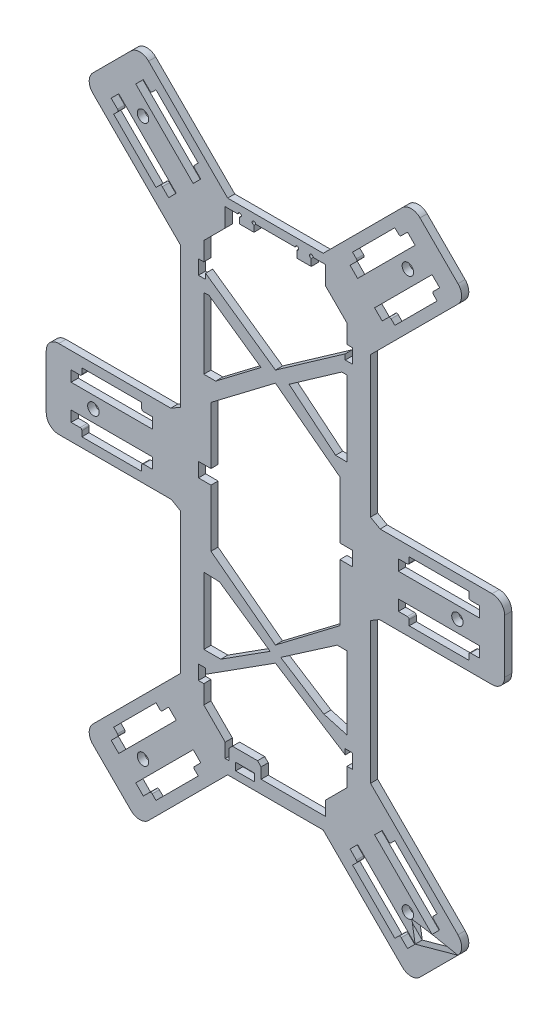
from build123d import *

# Parameters (mm, degrees)
SKETCH_1_R      = 1.6
SKETCH_1_W      = 5.20000048
SKETCH_1_H      = 2.099999983
EXTRUDE_1_DEPTH = 2
FILLET_1_R      = 3.5


with BuildPart() as part:
    # 草图1 → 凸台-拉伸1 (new body)
    with BuildSketch(Plane.XY):
        Polygon((-26.556292716, 51.843156425), (-26.556292716, 12.544385477), (-29.229747363, 11), (-64.005429013, 11), (-64.005429013, -11), (-29.033083059, -11), (-26.556292716, -12.466523206), (-26.556292716, -51.843156425), (-53.451522535, -78.738386244), (-37.895173349, -94.29473543), (-13.343143743, -69.742705824), (13.343143743, -69.742705824), (37.895173349, -94.29473543), (53.451522535, -78.738386244), (26.556292716, -51.843156425), (26.556292716, -12.466523206), (29.033083059, -11), (64.005429013, -11), (64.005429013, 11), (29.229747363, 11), (26.556292716, 12.544385477), (26.556292716, 51.843156425), (53.451522535, 78.738386244), (37.895173349, 94.29473543), (13.343143743, 69.742705824), (-13.343143743, 69.742705824), (-37.895173349, 94.29473543), (-53.451522535, 78.738386244), align=None)
        with Locations(Location((-36.982606728, 77.749638202, 0), (0, 0, 180))):
            Circle(SKETCH_1_R, mode=Mode.SUBTRACT)
        with Locations((-36.982606728, -77.749638202)):
            Circle(SKETCH_1_R, mode=Mode.SUBTRACT)
        with Locations(Location((36.982606728, -77.749638202, 0), (0, 0, 180))):
            Circle(SKETCH_1_R, mode=Mode.SUBTRACT)
        with Locations(Location((50.832714502, 9e-09, 0), (0, 0, 180))):
            Circle(SKETCH_1_R, mode=Mode.SUBTRACT)
        with Locations((-50.832714502, 9e-09)):
            Circle(SKETCH_1_R, mode=Mode.SUBTRACT)
        with Locations((36.982606728, 77.749638202)):
            Circle(SKETCH_1_R, mode=Mode.SUBTRACT)
        with BuildLine():
            Line((-36.890682834, 86.637970446), (-35.122915877, 84.870203489))
            ThreePointArc((-35.122915877, 84.870203489), (-34.76936249, 84.723756881), (-34.415809103, 84.870203489))
            Line((-34.415809103, 84.870203489), (-33.355148925, 85.930863667))
            Line((-33.355148925, 85.930863667), (-21.54646568, 74.122180422))
            Line((-21.54646568, 74.122180422), (-22.607125854, 73.061520248))
            ThreePointArc((-22.607125854, 73.061520248), (-22.753572462, 72.707966861), (-22.607125854, 72.354413474))
            Line((-22.607125854, 72.354413474), (-20.839358909, 70.586646528))
            Line((-20.839358909, 70.586646528), (-22.960679279, 68.465326158))
            Line((-22.960679279, 68.465326158), (-39.012003201, 84.516650079))
            Line((-39.012003201, 84.516650079), (-36.890682834, 86.637970446))
        make_face(mode=Mode.SUBTRACT)
        with BuildLine():
            Line((-44.10317202, 75.889947363), (-45.870938959, 77.657714302))
            Line((-45.870938959, 77.657714302), (-43.749618591, 79.779034671))
            Line((-43.749618591, 79.779034671), (-27.698294688, 63.727710768))
            Line((-27.698294688, 63.727710768), (-29.819615052, 61.606390403))
            Line((-29.819615052, 61.606390403), (-31.587381992, 63.374157343))
            ThreePointArc((-31.587381992, 63.374157343), (-31.940935379, 63.52060395), (-32.294488766, 63.374157343))
            Line((-32.294488766, 63.374157343), (-33.355148944, 62.313497165))
            Line((-33.355148944, 62.313497165), (-45.163832188, 74.122180408))
            Line((-45.163832188, 74.122180408), (-44.103172013, 75.182840582))
            ThreePointArc((-44.103172013, 75.182840582), (-43.956725405, 75.536393974), (-44.10317202, 75.889947363))
        make_face(mode=Mode.SUBTRACT)
        with BuildLine():
            Line((-45.163832188, -74.122180408), (-44.103172013, -75.182840582))
            ThreePointArc((-44.103172013, -75.182840582), (-43.956725405, -75.536393974), (-44.10317202, -75.889947363))
            Line((-44.10317202, -75.889947363), (-45.870938959, -77.657714302))
            Line((-45.870938959, -77.657714302), (-43.749618591, -79.779034671))
            Line((-43.749618591, -79.779034671), (-27.698294688, -63.727710768))
            Line((-27.698294688, -63.727710768), (-29.819615052, -61.606390403))
            Line((-29.819615052, -61.606390403), (-31.587381992, -63.374157343))
            ThreePointArc((-31.587381992, -63.374157343), (-31.940935379, -63.52060395), (-32.294488766, -63.374157343))
            Line((-32.294488766, -63.374157343), (-33.355148944, -62.313497165))
            Line((-33.355148944, -62.313497165), (-45.163832188, -74.122180408))
        make_face(mode=Mode.SUBTRACT)
        with BuildLine():
            Line((-21.54646568, -74.122180422), (-22.607125854, -73.061520248))
            ThreePointArc((-22.607125854, -73.061520248), (-22.753572462, -72.707966861), (-22.607125854, -72.354413474))
            Line((-22.607125854, -72.354413474), (-20.839358909, -70.586646528))
            Line((-20.839358909, -70.586646528), (-22.960679279, -68.465326158))
            Line((-22.960679279, -68.465326158), (-39.012003201, -84.516650079))
            Line((-39.012003201, -84.516650079), (-36.890682834, -86.637970446))
            Line((-36.890682834, -86.637970446), (-35.122915877, -84.870203489))
            ThreePointArc((-35.122915877, -84.870203489), (-34.76936249, -84.723756881), (-34.415809103, -84.870203489))
            Line((-34.415809103, -84.870203489), (-33.355148925, -85.930863667))
            Line((-33.355148925, -85.930863667), (-21.54646568, -74.122180422))
        make_face(mode=Mode.SUBTRACT)
        with BuildLine():
            Line((36.890682834, -86.637970446), (35.122915877, -84.870203489))
            ThreePointArc((35.122915877, -84.870203489), (34.76936249, -84.723756881), (34.415809103, -84.870203489))
            Line((34.415809103, -84.870203489), (33.355148925, -85.930863667))
            Line((33.355148925, -85.930863667), (21.54646568, -74.122180422))
            Line((21.54646568, -74.122180422), (22.607125854, -73.061520248))
            ThreePointArc((22.607125854, -73.061520248), (22.753572462, -72.707966861), (22.607125854, -72.354413474))
            Line((22.607125854, -72.354413474), (20.839358909, -70.586646528))
            Line((20.839358909, -70.586646528), (22.960679279, -68.465326158))
            Line((22.960679279, -68.465326158), (39.012003201, -84.516650079))
            Line((39.012003201, -84.516650079), (36.890682834, -86.637970446))
        make_face(mode=Mode.SUBTRACT)
        with BuildLine():
            Line((44.10317202, -75.889947363), (45.870938959, -77.657714302))
            Line((45.870938959, -77.657714302), (43.749618591, -79.779034671))
            Line((43.749618591, -79.779034671), (27.698294688, -63.727710768))
            Line((27.698294688, -63.727710768), (29.819615052, -61.606390403))
            Line((29.819615052, -61.606390403), (31.587381992, -63.374157343))
            ThreePointArc((31.587381992, -63.374157343), (31.940935379, -63.52060395), (32.294488766, -63.374157343))
            Line((32.294488766, -63.374157343), (33.355148944, -62.313497165))
            Line((33.355148944, -62.313497165), (45.163832188, -74.122180408))
            Line((45.163832188, -74.122180408), (44.103172013, -75.182840582))
            ThreePointArc((44.103172013, -75.182840582), (43.956725405, -75.536393974), (44.10317202, -75.889947363))
        make_face(mode=Mode.SUBTRACT)
        with Locations((-8.500000515, -66.614214344)):
            Rectangle(SKETCH_1_W, SKETCH_1_H, mode=Mode.SUBTRACT)
        Polygon((13.528986218, -41.624461883), (20.000000538, -43.441011743), (20.000000538, -23.083088156), (17.239662752, -23.083088156), (1.471001318, -33.927703554), align=None, mode=Mode.SUBTRACT)
        Polygon((-1.471001318, -33.927703554), (-15.608125856, -24.20514853), (-20.000000538, -24.037713193), (-20.000000538, -42.73048504), (-15.261717058, -42.73048504), align=None, mode=Mode.SUBTRACT)
        Polygon((-14.014716081, -66.142135104), (-12.99999939, -66.142135104), (-12.99999939, -63.14213502), (-12.000001089, -62.142135322), (-4.999999942, -62.142135322), (-3.999999778, -63.14213502), (-3.999999778, -66.142135104), (14.014717371, -66.142135104), (14.014717371, -62.156841961), (20.000000433, -56.171567844), (20.000000433, -50.999998793), (21.500000073, -50.999998793), (21.500000073, -47), (19.500000073, -47), (19.500000073, -48.500001178), (0, -36.052914104), (-19.500000073, -48.500001178), (-19.500000073, -47), (-21.500000073, -47), (-21.500000073, -50.999998793), (-20.000000538, -50.999998793), (-20.000000538, -56.171566449), (-14.014716081, -62.156841961), align=None, mode=Mode.SUBTRACT)
        with BuildLine():
            Line((54.052714512, 8.350000022), (54.052714512, 6.850000014))
            ThreePointArc((54.052714512, 6.850000014), (54.19916112, 6.496446627), (54.552714507, 6.350000019))
            Line((54.552714507, 6.350000019), (57.052714488, 6.350000019))
            Line((57.052714488, 6.350000019), (57.052714488, 3.349999981))
            Line((57.052714488, 3.349999981), (34.352714512, 3.349999981))
            Line((34.352714512, 3.349999981), (34.352714512, 6.350000018))
            Line((34.352714512, 6.350000018), (36.852714518, 6.350000018))
            ThreePointArc((36.852714518, 6.350000018), (37.206267905, 6.496446626), (37.352714513, 6.850000013))
            Line((37.352714513, 6.850000013), (37.352714513, 8.350000022))
            Line((37.352714513, 8.350000022), (54.052714512, 8.350000022))
        make_face(mode=Mode.SUBTRACT)
        with BuildLine():
            Line((54.052714507, -6.849999995), (54.052714507, -8.350000004))
            Line((54.052714507, -8.350000004), (37.35271451, -8.350000004))
            Line((37.35271451, -8.350000004), (37.35271451, -6.850000001))
            ThreePointArc((37.35271451, -6.850000001), (37.206267902, -6.496446613), (36.852714515, -6.350000006))
            Line((36.852714515, -6.350000006), (34.352714525, -6.350000006))
            Line((34.352714525, -6.350000006), (34.352714525, -3.34999997))
            Line((34.352714525, -3.34999997), (57.052714483, -3.34999997))
            Line((57.052714483, -3.34999997), (57.052714483, -6.35))
            Line((57.052714483, -6.35), (54.552714502, -6.35))
            ThreePointArc((54.552714502, -6.35), (54.199161115, -6.496446608), (54.052714507, -6.849999995))
        make_face(mode=Mode.SUBTRACT)
        Polygon((21.500000073, 2), (21.500000073, -2), (18.000000103, -2), (18.000000103, -17.999997586), (-9.85e-07, -31.671570837), (-18.00000021, -17.999997586), (-18.00000021, -2), (-21.500000073, -2), (-21.500000073, 2), (-18.00000021, 2), (-18.00000021, 18.000001311), (-9.85e-07, 31.671570837), (18.000000103, 18.000001311), (18.000000103, 2), align=None, mode=Mode.SUBTRACT)
        Polygon((-4.018224451, 33.440672617), (-18.535123967, 43.618559812), (-20.001933972, 43.56271287), (-20.001933972, 23.821064575), (-16.683399731, 23.821064575), align=None, mode=Mode.SUBTRACT)
        Polygon((16.802558383, 22.618822929), (20.001933972, 22.58927703), (20.001933972, 43.618559812), (18.535123967, 43.618559812), (3.807877689, 33.293197214), align=None, mode=Mode.SUBTRACT)
        with BuildLine():
            Line((-20.000000757, 56.171567846), (-20.000000757, 51.000000657))
            Line((-20.000000757, 51.000000657), (-21.500000073, 51.000000657))
            Line((-21.500000073, 51.000000657), (-21.500000073, 47))
            Line((-21.500000073, 47), (-19.500000073, 47))
            Line((-19.500000073, 47), (-19.500000073, 48.499995589))
            Line((-19.500000073, 48.499995589), (0, 34.828426062))
            Line((0, 34.828426062), (19.500000073, 48.499995589))
            Line((19.500000073, 48.499995589), (19.500000073, 47))
            Line((19.500000073, 47), (21.500000073, 47))
            Line((21.500000073, 47), (21.500000073, 50.999997831))
            Line((21.500000073, 50.999997831), (19.999998966, 50.999997831))
            Line((19.999998966, 50.999997831), (19.999999396, 56.171566418))
            Line((19.999999396, 56.171566418), (14.014716833, 62.15684103))
            Line((14.014716833, 62.15684103), (14.014717425, 67.343146742))
            Line((14.014717425, 67.343146742), (10.499999859, 67.343147034))
            ThreePointArc((10.499999859, 67.343147034), (9.646445327, 67.696701812), (9.999998826, 66.843146751))
            Line((9.999998826, 66.843146751), (9.999998826, 64.871536391))
            Line((9.999998826, 64.871536391), (5.99999817, 64.871536545))
            Line((5.99999817, 64.871536545), (5.99999817, 66.843146905))
            ThreePointArc((5.99999817, 66.843146905), (6.353555514, 67.6966992), (5.500000902, 67.34314745))
            Line((5.500000902, 67.34314745), (-5.500000902, 67.343148363))
            ThreePointArc((-5.500000902, 67.343148363), (-6.353555822, 67.696702161), (-6.000000052, 66.843148058))
            Line((-6.000000052, 66.843148058), (-6.000000052, 65.141825658))
            Line((-6.000000052, 65.141825658), (-10.000000708, 65.141825658))
            Line((-10.000000708, 65.141825658), (-10.000000708, 66.843148057))
            ThreePointArc((-10.000000708, 66.843148057), (-9.646445179, 67.696701626), (-10.499999858, 67.343148779))
            Line((-10.499999858, 67.343148779), (-14.014716027, 67.343149071))
            Line((-14.014716027, 67.343149071), (-14.0147163, 62.156843359))
            Line((-14.0147163, 62.156843359), (-20.000000757, 56.171567846))
        make_face(mode=Mode.SUBTRACT)
        with BuildLine():
            Line((-57.052714483, -6.35), (-54.552714502, -6.35))
            ThreePointArc((-54.552714502, -6.35), (-54.199161115, -6.496446608), (-54.052714507, -6.849999995))
            Line((-54.052714507, -6.849999995), (-54.052714507, -8.350000004))
            Line((-54.052714507, -8.350000004), (-37.35271451, -8.350000004))
            Line((-37.35271451, -8.350000004), (-37.35271451, -6.850000001))
            ThreePointArc((-37.35271451, -6.850000001), (-37.206267902, -6.496446613), (-36.852714515, -6.350000006))
            Line((-36.852714515, -6.350000006), (-34.352714525, -6.350000006))
            Line((-34.352714525, -6.350000006), (-34.352714525, -3.34999997))
            Line((-34.352714525, -3.34999997), (-57.052714483, -3.34999997))
            Line((-57.052714483, -3.34999997), (-57.052714483, -6.35))
        make_face(mode=Mode.SUBTRACT)
        with BuildLine():
            Line((-37.352714513, 8.350000022), (-54.052714512, 8.350000022))
            Line((-54.052714512, 8.350000022), (-54.052714512, 6.850000014))
            ThreePointArc((-54.052714512, 6.850000014), (-54.19916112, 6.496446627), (-54.552714507, 6.350000019))
            Line((-54.552714507, 6.350000019), (-57.052714488, 6.350000019))
            Line((-57.052714488, 6.350000019), (-57.052714488, 3.349999981))
            Line((-57.052714488, 3.349999981), (-34.352714512, 3.349999981))
            Line((-34.352714512, 3.349999981), (-34.352714512, 6.350000018))
            Line((-34.352714512, 6.350000018), (-36.852714518, 6.350000018))
            ThreePointArc((-36.852714518, 6.350000018), (-37.206267905, 6.496446626), (-37.352714513, 6.850000013))
            Line((-37.352714513, 6.850000013), (-37.352714513, 8.350000022))
        make_face(mode=Mode.SUBTRACT)
        with BuildLine():
            Line((45.163832188, 74.122180408), (44.103172013, 75.182840582))
            ThreePointArc((44.103172013, 75.182840582), (43.956725405, 75.536393974), (44.10317202, 75.889947363))
            Line((44.10317202, 75.889947363), (45.870938959, 77.657714302))
            Line((45.870938959, 77.657714302), (43.749618591, 79.779034671))
            Line((43.749618591, 79.779034671), (27.698294688, 63.727710768))
            Line((27.698294688, 63.727710768), (29.819615052, 61.606390403))
            Line((29.819615052, 61.606390403), (31.587381992, 63.374157343))
            ThreePointArc((31.587381992, 63.374157343), (31.940935379, 63.52060395), (32.294488766, 63.374157343))
            Line((32.294488766, 63.374157343), (33.355148944, 62.313497165))
            Line((33.355148944, 62.313497165), (45.163832188, 74.122180408))
        make_face(mode=Mode.SUBTRACT)
        with BuildLine():
            Line((21.54646568, 74.122180422), (22.607125854, 73.061520248))
            ThreePointArc((22.607125854, 73.061520248), (22.753572462, 72.707966861), (22.607125854, 72.354413474))
            Line((22.607125854, 72.354413474), (20.839358909, 70.586646528))
            Line((20.839358909, 70.586646528), (22.960679279, 68.465326158))
            Line((22.960679279, 68.465326158), (39.012003201, 84.516650079))
            Line((39.012003201, 84.516650079), (36.890682834, 86.637970446))
            Line((36.890682834, 86.637970446), (35.122915877, 84.870203489))
            ThreePointArc((35.122915877, 84.870203489), (34.76936249, 84.723756881), (34.415809103, 84.870203489))
            Line((34.415809103, 84.870203489), (33.355148925, 85.930863667))
            Line((33.355148925, 85.930863667), (21.54646568, 74.122180422))
        make_face(mode=Mode.SUBTRACT)
    extrude(amount=EXTRUDE_1_DEPTH)

    # 圆角1
    fillet_1_edges = [part.edges().sort_by_distance(p)[0] for p in [
        (37.895173349, 94.29473543, 1),
        (53.451522535, 78.738386244, 1),
        (64.005429013, 11, 1),
        (64.005429013, -11, 1),
        (53.451522535, -78.738386244, 1),
        (37.895173349, -94.29473543, 1),
        (-37.895173349, -94.29473543, 1),
        (-53.451522535, -78.738386244, 1),
        (-64.005429013, -11, 1),
        (-64.005429013, 11, 1),
        (-53.451522535, 78.738386244, 1),
        (-37.895173349, 94.29473543, 1),
    ]]
    fillet(fillet_1_edges, radius=FILLET_1_R)


solid = part.part
